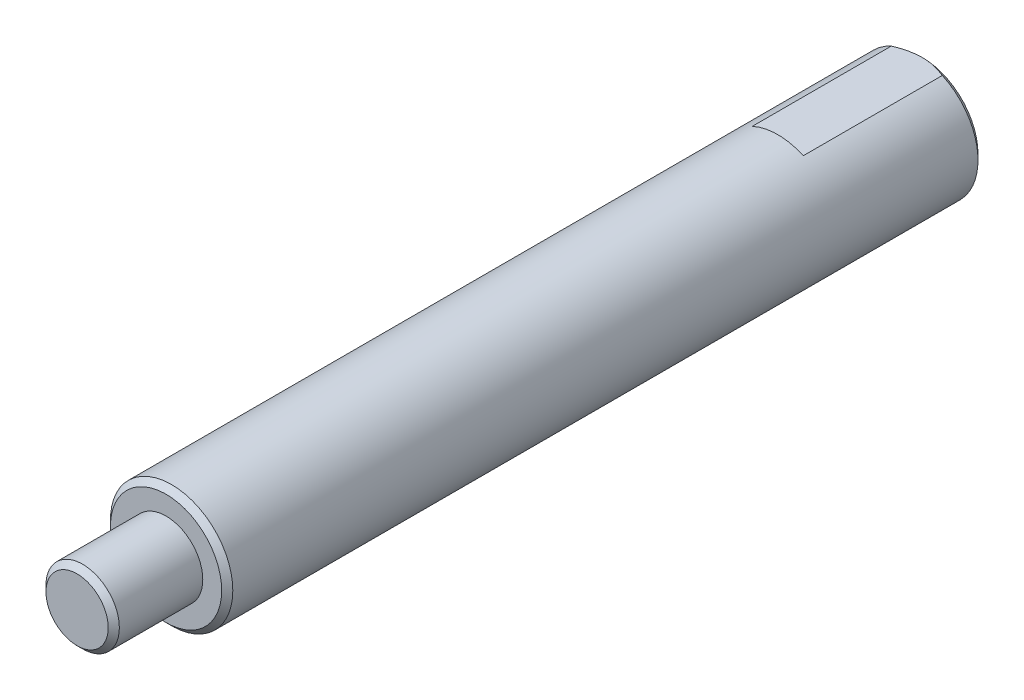
from build123d import *

# Parameters (mm, degrees)
SKETCH_1_R             = 5.5
EXTRUDE_1_DEPTH        = 68
CHAMFER_1_SIZE         = 0.5
SKETCH_2_R             = 3.3
EXTRUDE_2_DEPTH        = 8
CHAMFER_2_SIZE         = 0.5
HOLE_WIZARD_M5_1_D     = 4.2
HOLE_WIZARD_M5_1_DEPTH = 12.4
HOLE_WIZARD_M5_1_TIP   = 1.2618073
CHAMFER_3_SIZE         = 0.5
SKETCH_6_W             = 10
SKETCH_6_H             = 3
CUT_EXTRUDE_1_DEPTH    = 13


with BuildPart() as part:
    # 草图1 → 拉伸1 (new body)
    with BuildSketch(Plane.XY):
        Circle(SKETCH_1_R)
    extrude(amount=EXTRUDE_1_DEPTH)

    # 倒角1
    chamfer_1_edges = [part.edges().sort_by_distance(p)[0] for p in [
        (-5.5, 0, 0),
        (-5.5, 0, 68),
    ]]
    chamfer(chamfer_1_edges, length=CHAMFER_1_SIZE)

    # 草图2 → 拉伸2 (add)
    with BuildSketch(Plane.XY.offset(68)):
        Circle(SKETCH_2_R)
    extrude(amount=EXTRUDE_2_DEPTH)

    # 倒角2
    chamfer_2_edges = [part.edges().sort_by_distance(p)[0] for p in [
        (-3.3, 0, 76),
    ]]
    chamfer(chamfer_2_edges, length=CHAMFER_2_SIZE)

    # M5 螺纹孔1
    with Locations(Plane(origin=(0, 0, 0), x_dir=(-1, 0, 0), z_dir=(0, 0, -1))):
        with Locations((0, 0)):
            Hole(HOLE_WIZARD_M5_1_D / 2, depth=HOLE_WIZARD_M5_1_DEPTH)
            with Locations((0, 0, -(HOLE_WIZARD_M5_1_DEPTH + HOLE_WIZARD_M5_1_TIP / 2))):  # 118° drill point
                Cone(0, HOLE_WIZARD_M5_1_D / 2, HOLE_WIZARD_M5_1_TIP, mode=Mode.SUBTRACT)

    # 倒角3
    chamfer_3_edges = [part.edges().sort_by_distance(p)[0] for p in [
        (-2.1, 0, 0),
    ]]
    chamfer(chamfer_3_edges, length=CHAMFER_3_SIZE)

    # 草图6 → 切除-拉伸1 (cut)
    with BuildSketch(Plane(origin=(0, 0, 0), x_dir=(-1, 0, 0), z_dir=(0, 0, -1))):
        with Locations((0, 6.5)):
            Rectangle(SKETCH_6_W, SKETCH_6_H)
        with Locations((0, -6.5)):
            Rectangle(SKETCH_6_W, SKETCH_6_H)
    extrude(amount=-CUT_EXTRUDE_1_DEPTH, mode=Mode.SUBTRACT)


solid = part.part
